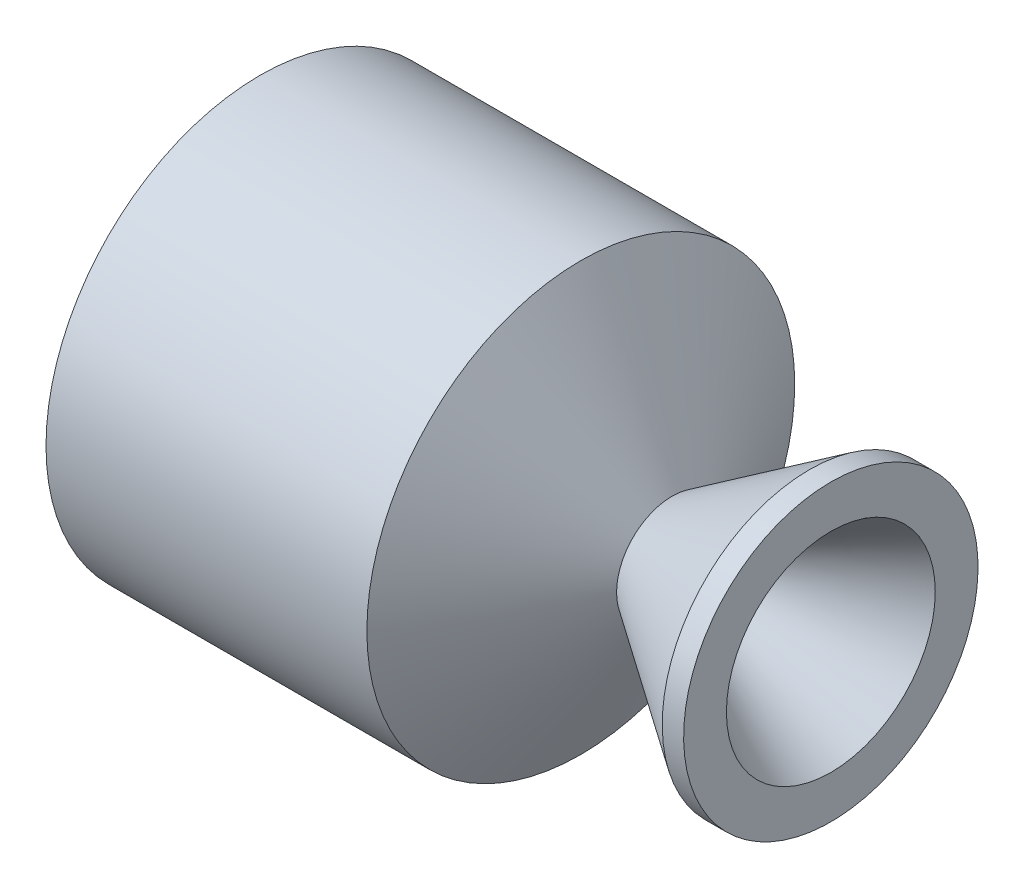
from build123d import *


with BuildPart() as part:
    # Sketch1 → Revolve1 (revolve)
    with BuildSketch(Plane.XY):
        Polygon((0, 0.6), (7.41583084, 4.881531932), (7.41583084, 6.881531932), (6.41583084, 6.881531932), (0, 2.6), (-4.272391992, 10), (-19.272391992, 10), (-19.272391992, 0.6), (-18.272391992, 0.6), (-18.272391992, 9), (-4.849742261, 9), align=None)
    revolve(axis=Axis((7.41583084, 0, 0), (-1, 0, 0)))


solid = part.part
